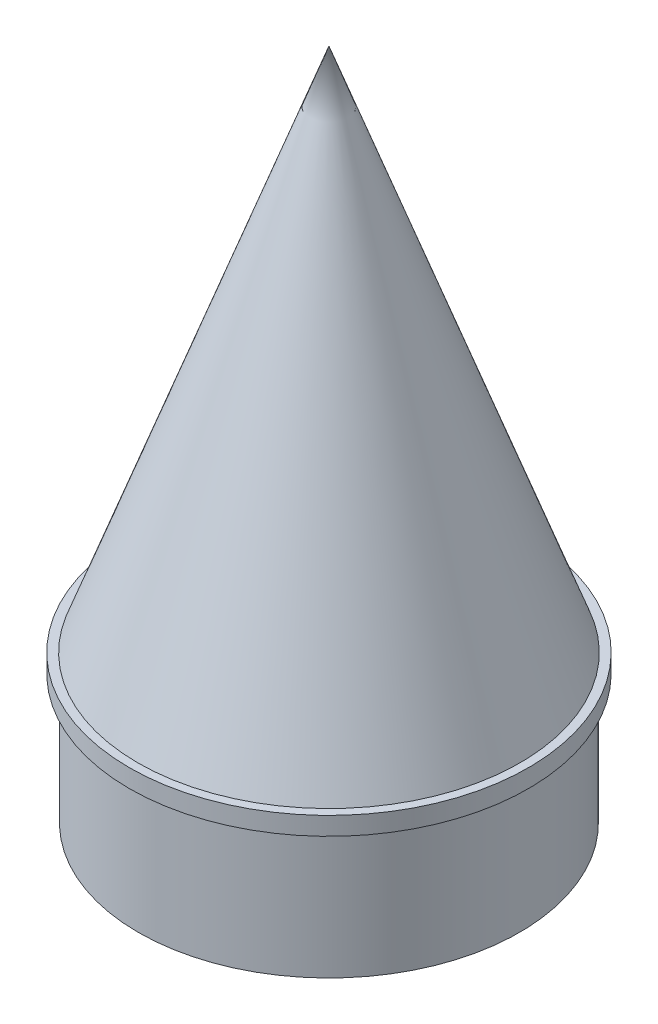
from build123d import *

# Parameters (mm, degrees)
CUT_EXTRUDE1_DEPTH = 3


with BuildPart() as part:
    # Sketch1 → Revolve1 (revolve)
    with BuildSketch(Plane.XY, mode=Mode.PRIVATE) as revolve1_sk:
        Polygon((0, 0), (-22.225, 0), (-22.225, 2.1082), (0, 63.170885647), (0, 60.127205267), (-20.064661815, 5), (0, 5), align=None)
    revolve(revolve1_sk.sketch.rotate(Axis((0, 0, 0), (0, 1, 0)), 270), axis=Axis((0, 0, 0), (0, 1, 0)))

    # Sketch9 → Revolve3 (revolve)
    with BuildSketch(Plane.XY, mode=Mode.PRIVATE) as revolve3_sk:
        Polygon((-22.1611, 0), (-22.1611, -15), (-21.1201, -15), (-21.1201, 2.1082), (-23.2021, 2.1082), (-23.2021, 0), align=None)
    revolve(revolve3_sk.sketch.rotate(Axis((0, 63.536813388, 0), (0, -1, 0)), 270), axis=Axis((0, 63.536813388, 0), (0, -1, 0)))

    # Sketch10 → Cut-Extrude1 (cut)
    with BuildSketch(Plane.XZ):
        Polygon((-5.25, 13.25), (5.25, 13.25), (5.25, 10.25), (16.25, 10.25), (16.25, -10.25), (5.25, -10.25), (5.25, -13.25), (-5.25, -13.25), (-5.25, -10.25), (-16.25, -10.25), (-16.25, 10.25), (-5.25, 10.25), align=None)
    extrude(amount=-CUT_EXTRUDE1_DEPTH, mode=Mode.SUBTRACT)


solid = part.part
